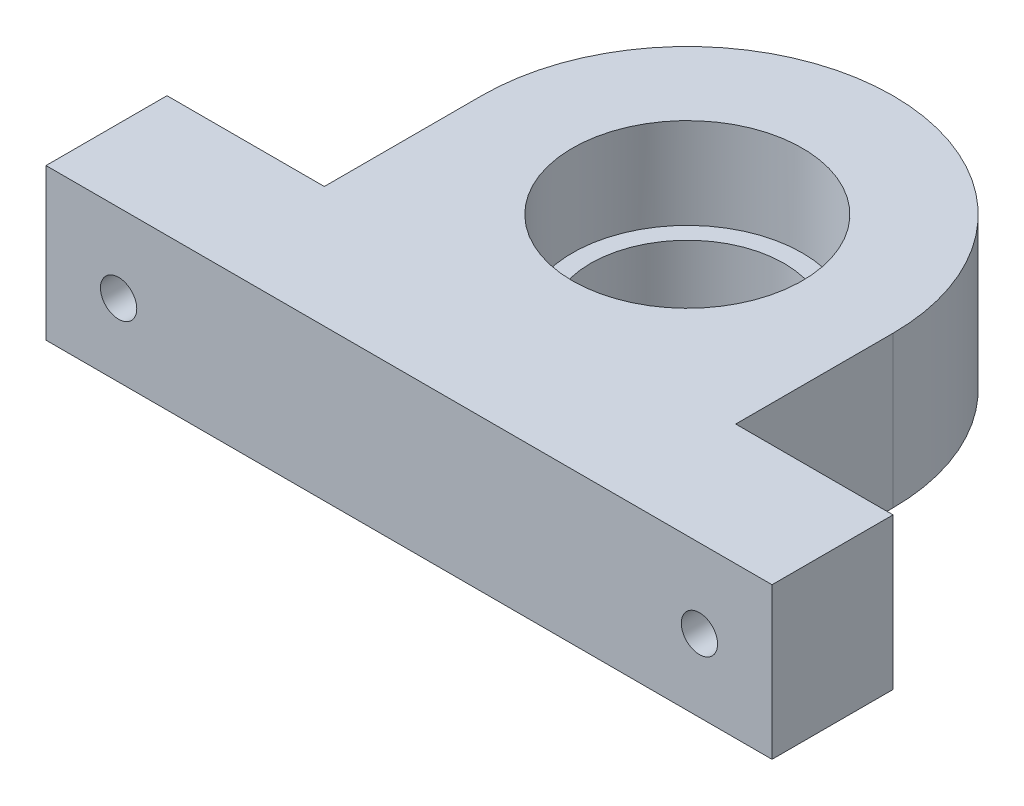
from build123d import *

# Parameters (mm, degrees)
SKETCH_1_W          = 60
SKETCH_1_H          = 70
EXTRUDE_1_DEPTH     = 10
SKETCH_2_R          = 3
CUT_EXTRUDE_1_DEPTH = 48.16990566
CUT_EXTRUDE_START   = -4
SKETCH_3_R          = 7.5
SKETCH_3_R_2        = 3
CUT_EXTRUDE_2_DEPTH = 4
SKETCH_4_R          = 5
CUT_EXTRUDE_3_DEPTH = 1
EXTRUDE_2_DEPTH     = 12.5
SKETCH_7_R          = 9.5
CUT_EXTRUDE_4_DEPTH = 12.5
CUT_EXTRUDE_5_DEPTH = 57.5
SKETCH_9_R          = 1.5
CUT_EXTRUDE_6_DEPTH = 62.032778079
SKETCH_10_W         = 13
SKETCH_10_H         = 12.5
CUT_EXTRUDE_7_DEPTH = 13
SKETCH_11_W         = 13
SKETCH_11_H         = 12.5
CUT_EXTRUDE_8_DEPTH = 13
EXTRUDE_START       = -5
SKETCH_12_R         = 9.5
SKETCH_12_R_2       = 8
EXTRUDE_3_DEPTH     = 5


with BuildPart() as part:
    # 草图1 → 凸台-拉伸1 (new body)
    with BuildSketch(Plane.XY):
        Rectangle(SKETCH_1_W, SKETCH_1_H)
    extrude(amount=EXTRUDE_1_DEPTH)

    # 草图2 → 切除-拉伸1 (cut, through all)
    with BuildSketch(Plane.XY.offset(10)):
        with Locations((-8, 15)):
            Circle(SKETCH_2_R)
        with Locations((7, 15)):
            Circle(SKETCH_2_R)
        with Locations((-8, -15)):
            Circle(SKETCH_2_R)
        with Locations((7, -15)):
            Circle(SKETCH_2_R)
        with Locations((22, 15)):
            Circle(SKETCH_2_R)
        with Locations((22, -15)):
            Circle(SKETCH_2_R)
    extrude(amount=-CUT_EXTRUDE_1_DEPTH, mode=Mode.SUBTRACT)

    # 草图3 → 切除-拉伸2 (cut)
    # profile 1 of 2: a face of its own
    with BuildSketch(Plane(origin=(0, 0, 0), x_dir=(-1, 0, 0), z_dir=(0, 0, -1)).offset(CUT_EXTRUDE_START)):
        with Locations((8, 15)):
            Circle(SKETCH_3_R)
        with Locations(Location((8, 15, 0), (0, 0, 180))):
            Circle(SKETCH_3_R_2, mode=Mode.SUBTRACT)
    # profile 2 of 2: a face of its own
    with BuildSketch(Plane(origin=(0, 0, 0), x_dir=(-1, 0, 0), z_dir=(0, 0, -1)).offset(CUT_EXTRUDE_START)):
        with BuildLine():
            ThreePointArc((8, 7.5), (0.5, 15), (8, 22.5))
            Line((8, 22.5), (-30, 22.5))
            Line((-30, 22.5), (-30, 7.5))
            Line((-30, 7.5), (8, 7.5))
        make_face()
        with Locations(Location((-7, 15, 0), (0, 0, 180))):
            Circle(SKETCH_3_R_2, mode=Mode.SUBTRACT)
    cut_extrude_2 = extrude(amount=CUT_EXTRUDE_2_DEPTH, mode=Mode.SUBTRACT)

    # 镜向1: 切除-拉伸2 across plane
    add(cut_extrude_2.mirror(Plane.ZX), mode=Mode.SUBTRACT)

    # 草图4 → 切除-拉伸3 (cut)
    with BuildSketch(Plane.XY.offset(10)):
        with Locations((-20, 0)):
            Circle(SKETCH_4_R)
        with BuildLine():
            ThreePointArc((-20, -5), (-25, 0), (-20, 5))
            Line((-20, 5), (-30, 5))
            Line((-30, 5), (-30, -5))
            Line((-30, -5), (-20, -5))
        make_face()
    extrude(amount=-CUT_EXTRUDE_3_DEPTH, mode=Mode.SUBTRACT)

    # 草图6 → 凸台-拉伸2 (add)
    with BuildSketch(Plane(origin=(0, 35, 0), x_dir=(1, 0, 0), z_dir=(0, 1, 0))):
        with BuildLine():
            ThreePointArc((30, 0), (20.807611845, 3.807611845), (17, 13))
            ThreePointArc((17, 13), (0, 30), (-17, 13))
            ThreePointArc((-17, 13), (-20.807611845, 3.807611845), (-30, 0))
            Line((-30, 0), (30, 0))
        make_face()
    extrude_2 = extrude(amount=-EXTRUDE_2_DEPTH)

    # 草图7 → 切除-拉伸4 (cut)
    with BuildSketch(Plane(origin=(0, 35, 0), x_dir=(1, 0, 0), z_dir=(0, 1, 0))):
        with Locations(Location((0, 13, 0), (0, 0, 270))):
            Circle(SKETCH_7_R)
    cut_extrude_4 = extrude(amount=-CUT_EXTRUDE_4_DEPTH, mode=Mode.SUBTRACT)

    # 镜向2: 凸台-拉伸2, 切除-拉伸4 across plane
    add(extrude_2.mirror(Plane.ZX))
    add(cut_extrude_4.mirror(Plane.ZX), mode=Mode.SUBTRACT)

    # 草图8 → 切除-拉伸5 (cut)
    with BuildSketch(Plane.XZ.offset(35)):
        with BuildLine():
            Line((-30, 10), (-30, 0))
            ThreePointArc((-30, 0), (-20.807611845, -3.807611845), (-17, -13))
            ThreePointArc((-17, -13), (0, -30), (17, -13))
            ThreePointArc((17, -13), (20.807611845, -3.807611845), (30, 0))
            Line((30, 0), (30, 10))
            Line((30, 10), (-30, 10))
        make_face()
    extrude(amount=-CUT_EXTRUDE_5_DEPTH, mode=Mode.SUBTRACT)

    # 草图9 → 切除-拉伸6 (cut, through all)
    with BuildSketch(Plane.XY.offset(10)):
        with Locations((-24, 28.5)):
            Circle(SKETCH_9_R)
        with Locations((24, 28.5)):
            Circle(SKETCH_9_R)
    extrude(amount=-CUT_EXTRUDE_6_DEPTH, mode=Mode.SUBTRACT)

    # 草图10 → 切除-拉伸7 (cut)
    with BuildSketch(Plane(origin=(30, 0, 0), x_dir=(0, 0, -1), z_dir=(1, 0, 0))):
        with Locations((6.5, 28.75)):
            Rectangle(SKETCH_10_W, SKETCH_10_H)
    extrude(amount=-CUT_EXTRUDE_7_DEPTH, mode=Mode.SUBTRACT)

    # 草图11 → 切除-拉伸8 (cut)
    with BuildSketch(Plane.ZY.offset(30)):
        with Locations((-6.5, 28.75)):
            Rectangle(SKETCH_11_W, SKETCH_11_H)
    extrude(amount=-CUT_EXTRUDE_8_DEPTH, mode=Mode.SUBTRACT)

    # 草图12 → 凸台-拉伸3 (add)
    with BuildSketch(Plane.XZ.offset(-22.5).offset(EXTRUDE_START)):
        with Locations(Location((0, -13, 0), (0, 0, 90))):
            Circle(SKETCH_12_R)
        with Locations(Location((0, -13, 0), (0, 0, 270))):
            Circle(SKETCH_12_R_2, mode=Mode.SUBTRACT)
    extrude(amount=EXTRUDE_3_DEPTH)


solid = part.part
